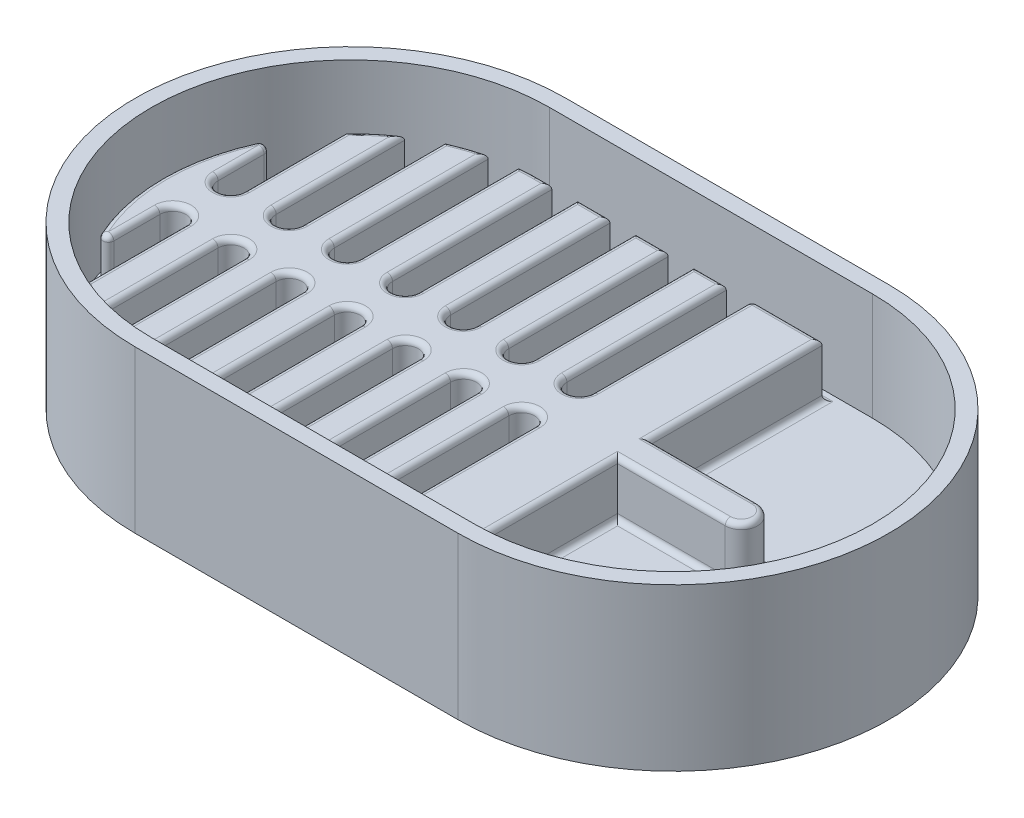
from build123d import *

# Parameters (mm, degrees)
BOSS_EXTRUDE1_DEPTH = 10
BOSS_EXTRUDE2_DEPTH = 5
BOSS_EXTRUDE4_DEPTH = 10
BOSS_EXTRUDE5_DEPTH = 5
FILLET1_R           = 0.5


with BuildPart() as part:
    # Sketch5 → Boss-Extrude1 (new body)
    with BuildSketch(Plane(origin=(0, 0, 0), x_dir=(1, 0, 0), z_dir=(0, 1, 0))):
        with BuildLine():
            ThreePointArc((-12.6, 2.7), (-13.8, 1.5), (-15, 2.7))
            Line((-15, 2.7), (-15, 9.013878189))
            ThreePointArc((-15, 9.013878189), (-17.5, 0), (-15, -9.013878189))
            Line((-15, -9.013878189), (-15, -2.7))
            ThreePointArc((-15, -2.7), (-13.8, -1.5), (-12.6, -2.7))
            Line((-12.6, -2.7), (-12.6, -12.144546101))
            ThreePointArc((-12.6, -12.144546101), (-11.169450578, -13.471947661), (-9.6, -14.631814652))
            Line((-9.6, -14.631814652), (-9.6, -2.7))
            ThreePointArc((-9.6, -2.7), (-8.4, -1.5), (-7.2, -2.7))
            Line((-7.2, -2.7), (-7.2, -15.950235108))
            ThreePointArc((-7.2, -15.950235108), (-5.723592557, -16.53754783), (-4.2, -16.988525539))
            Line((-4.2, -16.988525539), (-4.2, -2.7))
            ThreePointArc((-4.2, -2.7), (-3, -1.5), (-1.8, -2.7))
            Line((-1.8, -2.7), (-1.8, -17.407182426))
            ThreePointArc((-1.8, -17.407182426), (-0.901195748, -17.476780202), (0, -17.5))
            Line((0, -17.5), (1.2, -17.5))
            Line((1.2, -17.5), (1.2, -2.7))
            ThreePointArc((1.2, -2.7), (2.4, -1.5), (3.6, -2.7))
            Line((3.6, -2.7), (3.6, -17.5))
            Line((3.6, -17.5), (6.6, -17.5))
            Line((6.6, -17.5), (6.6, -2.7))
            ThreePointArc((6.6, -2.7), (7.8, -1.5), (9, -2.7))
            Line((9, -2.7), (9, -17.5))
            Line((9, -17.5), (12, -17.5))
            Line((12, -17.5), (12, -2.7))
            ThreePointArc((12, -2.7), (13.2, -1.5), (14.4, -2.7))
            Line((14.4, -2.7), (14.4, -17.5))
            Line((14.4, -17.5), (17.4, -17.5))
            Line((17.4, -17.5), (17.4, -2.7))
            ThreePointArc((17.4, -2.7), (18.6, -1.5), (19.8, -2.7))
            Line((19.8, -2.7), (19.8, -17.5))
            Line((19.8, -17.5), (26.3, -17.5))
            Line((26.3, -17.5), (26.3, -1.5))
            Line((26.3, -1.5), (36.3, -1.5))
            ThreePointArc((36.3, -1.5), (37.8, 0), (36.3, 1.5))
            Line((36.3, 1.5), (26.3, 1.5))
            Line((26.3, 1.5), (26.3, 17.5))
            Line((26.3, 17.5), (19.8, 17.5))
            Line((19.8, 17.5), (19.8, 2.7))
            ThreePointArc((19.8, 2.7), (18.6, 1.5), (17.4, 2.7))
            Line((17.4, 2.7), (17.4, 17.5))
            Line((17.4, 17.5), (14.4, 17.5))
            Line((14.4, 17.5), (14.4, 2.7))
            ThreePointArc((14.4, 2.7), (13.2, 1.5), (12, 2.7))
            Line((12, 2.7), (12, 17.5))
            Line((12, 17.5), (9, 17.5))
            Line((9, 17.5), (9, 2.7))
            ThreePointArc((9, 2.7), (7.8, 1.5), (6.6, 2.7))
            Line((6.6, 2.7), (6.6, 17.5))
            Line((6.6, 17.5), (3.6, 17.5))
            Line((3.6, 17.5), (3.6, 2.7))
            ThreePointArc((3.6, 2.7), (2.4, 1.5), (1.2, 2.7))
            Line((1.2, 2.7), (1.2, 17.5))
            Line((1.2, 17.5), (0, 17.5))
            ThreePointArc((0, 17.5), (-0.901195748, 17.476780202), (-1.8, 17.407182426))
            Line((-1.8, 17.407182426), (-1.8, 2.7))
            ThreePointArc((-1.8, 2.7), (-3, 1.5), (-4.2, 2.7))
            Line((-4.2, 2.7), (-4.2, 16.988525539))
            ThreePointArc((-4.2, 16.988525539), (-5.723592557, 16.53754783), (-7.2, 15.950235108))
            Line((-7.2, 15.950235108), (-7.2, 2.7))
            ThreePointArc((-7.2, 2.7), (-8.4, 1.5), (-9.6, 2.7))
            Line((-9.6, 2.7), (-9.6, 14.631814652))
            ThreePointArc((-9.6, 14.631814652), (-11.169450578, 13.471947661), (-12.6, 12.144546101))
            Line((-12.6, 12.144546101), (-12.6, 2.7))
        make_face()
    extrude(amount=BOSS_EXTRUDE1_DEPTH)

    # Sketch5<3> → Boss-Extrude2 (add)
    with BuildSketch(Plane(origin=(0, 0, 0), x_dir=(1, 0, 0), z_dir=(0, 1, 0))):
        with BuildLine():
            ThreePointArc((0, 18.5), (-18.5, 0), (0, -18.5))
            Line((0, -18.5), (30, -18.5))
            ThreePointArc((30, -18.5), (48.5, 0), (30, 18.5))
            Line((30, 18.5), (0, 18.5))
        make_face()
        with BuildLine():
            Line((-15, 9.013878189), (-15, 2.7))
            ThreePointArc((-15, 2.7), (-13.8, 1.5), (-12.6, 2.7))
            Line((-12.6, 2.7), (-12.6, 12.144546101))
            ThreePointArc((-12.6, 12.144546101), (-11.169450578, 13.471947661), (-9.6, 14.631814652))
            Line((-9.6, 14.631814652), (-9.6, 2.7))
            ThreePointArc((-9.6, 2.7), (-8.4, 1.5), (-7.2, 2.7))
            Line((-7.2, 2.7), (-7.2, 15.950235108))
            ThreePointArc((-7.2, 15.950235108), (-5.723592557, 16.53754783), (-4.2, 16.988525539))
            Line((-4.2, 16.988525539), (-4.2, 2.7))
            ThreePointArc((-4.2, 2.7), (-3, 1.5), (-1.8, 2.7))
            Line((-1.8, 2.7), (-1.8, 17.407182426))
            ThreePointArc((-1.8, 17.407182426), (-0.901195748, 17.476780202), (0, 17.5))
            Line((0, 17.5), (1.2, 17.5))
            Line((1.2, 17.5), (1.2, 2.7))
            ThreePointArc((1.2, 2.7), (2.4, 1.5), (3.6, 2.7))
            Line((3.6, 2.7), (3.6, 17.5))
            Line((3.6, 17.5), (6.6, 17.5))
            Line((6.6, 17.5), (6.6, 2.7))
            ThreePointArc((6.6, 2.7), (7.8, 1.5), (9, 2.7))
            Line((9, 2.7), (9, 17.5))
            Line((9, 17.5), (12, 17.5))
            Line((12, 17.5), (12, 2.7))
            ThreePointArc((12, 2.7), (13.2, 1.5), (14.4, 2.7))
            Line((14.4, 2.7), (14.4, 17.5))
            Line((14.4, 17.5), (17.4, 17.5))
            Line((17.4, 17.5), (17.4, 2.7))
            ThreePointArc((17.4, 2.7), (18.6, 1.5), (19.8, 2.7))
            Line((19.8, 2.7), (19.8, 17.5))
            Line((19.8, 17.5), (26.3, 17.5))
            Line((26.3, 17.5), (26.3, 1.5))
            Line((26.3, 1.5), (36.3, 1.5))
            ThreePointArc((36.3, 1.5), (37.8, 0), (36.3, -1.5))
            Line((36.3, -1.5), (26.3, -1.5))
            Line((26.3, -1.5), (26.3, -17.5))
            Line((26.3, -17.5), (19.8, -17.5))
            Line((19.8, -17.5), (19.8, -2.7))
            ThreePointArc((19.8, -2.7), (18.6, -1.5), (17.4, -2.7))
            Line((17.4, -2.7), (17.4, -17.5))
            Line((17.4, -17.5), (14.4, -17.5))
            Line((14.4, -17.5), (14.4, -2.7))
            ThreePointArc((14.4, -2.7), (13.2, -1.5), (12, -2.7))
            Line((12, -2.7), (12, -17.5))
            Line((12, -17.5), (9, -17.5))
            Line((9, -17.5), (9, -2.7))
            ThreePointArc((9, -2.7), (7.8, -1.5), (6.6, -2.7))
            Line((6.6, -2.7), (6.6, -17.5))
            Line((6.6, -17.5), (3.6, -17.5))
            Line((3.6, -17.5), (3.6, -2.7))
            ThreePointArc((3.6, -2.7), (2.4, -1.5), (1.2, -2.7))
            Line((1.2, -2.7), (1.2, -17.5))
            Line((1.2, -17.5), (0, -17.5))
            ThreePointArc((0, -17.5), (-0.901195748, -17.476780202), (-1.8, -17.407182426))
            Line((-1.8, -17.407182426), (-1.8, -2.7))
            ThreePointArc((-1.8, -2.7), (-3, -1.5), (-4.2, -2.7))
            Line((-4.2, -2.7), (-4.2, -16.988525539))
            ThreePointArc((-4.2, -16.988525539), (-5.723592557, -16.53754783), (-7.2, -15.950235108))
            Line((-7.2, -15.950235108), (-7.2, -2.7))
            ThreePointArc((-7.2, -2.7), (-8.4, -1.5), (-9.6, -2.7))
            Line((-9.6, -2.7), (-9.6, -14.631814652))
            ThreePointArc((-9.6, -14.631814652), (-11.169450578, -13.471947661), (-12.6, -12.144546101))
            Line((-12.6, -12.144546101), (-12.6, -2.7))
            ThreePointArc((-12.6, -2.7), (-13.8, -1.5), (-15, -2.7))
            Line((-15, -2.7), (-15, -9.013878189))
            ThreePointArc((-15, -9.013878189), (-17.5, 0), (-15, 9.013878189))
        make_face(mode=Mode.SUBTRACT)
    extrude(amount=BOSS_EXTRUDE2_DEPTH)



with BuildPart() as body_2:
    # Sketch6 → Boss-Extrude4 (new body)
    with BuildSketch(Plane(origin=(0, 5, 0), x_dir=(1, 0, 0), z_dir=(0, 1, 0))):
        with BuildLine():
            Line((30, 20), (0, 20))
            ThreePointArc((0, 20), (-20, 0), (0, -20))
            Line((0, -20), (30, -20))
            ThreePointArc((30, -20), (50, 0), (30, 20))
        make_face()
        with BuildLine():
            ThreePointArc((0, 18.5), (-18.5, 0), (0, -18.5))
            Line((0, -18.5), (30, -18.5))
            ThreePointArc((30, -18.5), (48.5, 0), (30, 18.5))
            Line((30, 18.5), (0, 18.5))
        make_face(mode=Mode.SUBTRACT)
    extrude(amount=BOSS_EXTRUDE4_DEPTH)


with BuildPart() as part_1:
    add(part.part)

    add(body_2.part)  # Boss-Extrude5 merges body 2
    # Sketch6<4> → Boss-Extrude5 (add)
    with BuildSketch(Plane(origin=(0, 5, 0), x_dir=(1, 0, 0), z_dir=(0, 1, 0))):
        with BuildLine():
            Line((30, 20), (0, 20))
            ThreePointArc((0, 20), (-20, 0), (0, -20))
            Line((0, -20), (30, -20))
            ThreePointArc((30, -20), (50, 0), (30, 20))
        make_face()
    extrude(amount=-BOSS_EXTRUDE5_DEPTH)

    # Fillet1
    fillet1_edges = [part_1.edges().sort_by_distance(p)[0] for p in [
        (-3, 10, 1.5),
        (-1.8, 10, 10.053591213),
        (-5.723592557, 10, -16.53754783),
        (-0.901195748, 10, 17.476780202),
        (0.6, 10, 17.5),
        (19.8, 7.5, -17.5),
        (1.2, 10, 10.1),
        (-15, 7.5, 9.013878189),
        (-15, 7.5, -9.013878189),
        (2.4, 10, 1.5),
        (3.6, 10, 10.1),
        (5.1, 10, 17.5),
        (6.6, 10, 10.1),
        (7.8, 10, 1.5),
        (9, 10, 10.1),
        (10.5, 10, 17.5),
        (-7.2, 10, -9.325117554),
        (12, 10, 10.1),
        (13.2, 10, 1.5),
        (14.4, 10, 10.1),
        (15.9, 10, 17.5),
        (17.4, 10, 10.1),
        (18.6, 10, 1.5),
        (19.8, 10, 10.1),
        (23.05, 10, 17.5),
        (26.3, 10, 9.5),
        (31.3, 10, 1.5),
        (-8.4, 10, -1.5),
        (37.8, 10, 0),
        (31.3, 10, -1.5),
        (26.3, 10, -9.5),
        (23.05, 10, -17.5),
        (19.8, 10, -10.1),
        (18.6, 10, -1.5),
        (17.4, 10, -10.1),
        (15.9, 10, -17.5),
        (37.8, 5, 0),
        (19.8, 5, 10.1),
        (18.6, 5, 1.5),
        (14.4, 10, -10.1),
        (14.4, 5, 10.1),
        (13.2, 5, 1.5),
        (9, 5, 10.1),
        (7.8, 5, 1.5),
        (3.6, 5, 10.1),
        (2.4, 5, 1.5),
        (13.2, 10, -1.5),
        (-1.8, 5, 10.053591213),
        (-3, 5, 1.5),
        (-7.2, 5, 9.325117554),
        (-8.4, 5, 1.5),
        (-9.6, 10, -8.665907326),
        (-12.6, 5, 7.422273051),
        (-13.8, 5, 1.5),
        (-17.5, 5, 0),
        (12, 10, -10.1),
        (-15, 5, -5.856939094),
        (-9.6, 5, -8.665907326),
        (-4.2, 5, -9.84426277),
        (10.5, 10, -17.5),
        (1.2, 5, -10.1),
        (6.6, 5, -10.1),
        (12, 5, -10.1),
        (9, 10, -10.1),
        (17.4, 5, -10.1),
        (31.3, 5, -1.5),
        (31.3, 5, 1.5),
        (26.3, 5, 9.5),
        (17.4, 5, 10.1),
        (12, 5, 10.1),
        (6.6, 5, 10.1),
        (1.2, 5, 10.1),
        (-4.2, 5, 9.84426277),
        (7.8, 10, -1.5),
        (-9.6, 5, 8.665907326),
        (-15, 5, 5.856939094),
        (-13.8, 5, -1.5),
        (-12.6, 5, -7.422273051),
        (-8.4, 5, -1.5),
        (-7.2, 5, -9.325117554),
        (-3, 5, -1.5),
        (-1.8, 5, -10.053591213),
        (2.4, 5, -1.5),
        (3.6, 5, -10.1),
        (7.8, 5, -1.5),
        (9, 5, -10.1),
        (13.2, 5, -1.5),
        (6.6, 10, -10.1),
        (14.4, 5, -10.1),
        (18.6, 5, -1.5),
        (19.8, 5, -10.1),
        (23.05, 5, -17.5),
        (26.3, 5, -9.5),
        (5.1, 10, -17.5),
        (3.6, 10, -10.1),
        (2.4, 10, -1.5),
        (1.2, 10, -10.1),
        (0.6, 10, -17.5),
        (-11.169450578, 10, -13.471947661),
        (-0.901195748, 10, -17.476780202),
        (-1.8, 10, -10.053591213),
        (-3, 10, -1.5),
        (-12.6, 10, -7.422273051),
        (-13.8, 10, -1.5),
        (-15, 10, -5.856939094),
        (-17.5, 10, 0),
        (-15, 10, 5.856939094),
        (-4.2, 10, -9.84426277),
        (-13.8, 10, 1.5),
        (-12.6, 10, 7.422273051),
        (-11.169450578, 10, 13.471947661),
        (-9.6, 10, 8.665907326),
        (-8.4, 10, 1.5),
        (-7.2, 10, 9.325117554),
        (-5.723592557, 10, 16.53754783),
        (-4.2, 10, 9.84426277),
    ]]
    fillet(fillet1_edges, radius=FILLET1_R)


solid = part_1.part
